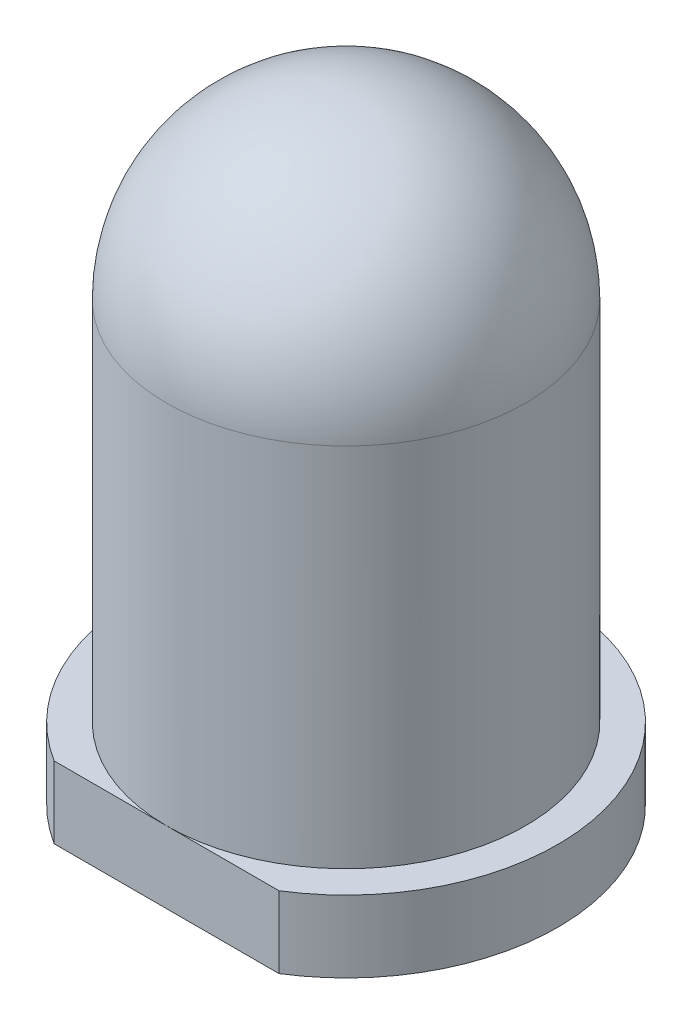
from build123d import *

# Parameters (mm, degrees)
SKETCH1_R     = 2.5
BASE_DEPTH    = 8.6
DOME_R        = 2.5
BASECUT_DEPTH = 1


with BuildPart() as part:
    # Sketch1 → Base (new body)
    with BuildSketch(Plane(origin=(0, 0, 0), x_dir=(1, 0, 0), z_dir=(0, 1, 0))):
        with Locations(Location((0, 0, 0), (0, 0, 90))):
            Circle(SKETCH1_R)
    extrude(amount=BASE_DEPTH)

    # Dome
    dome_edges = [part.edges().sort_by_distance(p)[0] for p in [
        (0, 8.6, 2.5),
    ]]
    fillet(dome_edges, radius=DOME_R)

    # BaseCutSketch → BaseCut (add)
    with BuildSketch(Plane(origin=(0, 0, 0), x_dir=(1, 0, 0), z_dir=(0, 1, 0))):
        with BuildLine():
            Line((1.566045976, -2.5), (-1.566045976, -2.5))
            ThreePointArc((-1.566045976, -2.5), (0, 2.95), (1.566045976, -2.5))
        make_face()
    extrude(amount=BASECUT_DEPTH)


solid = part.part
